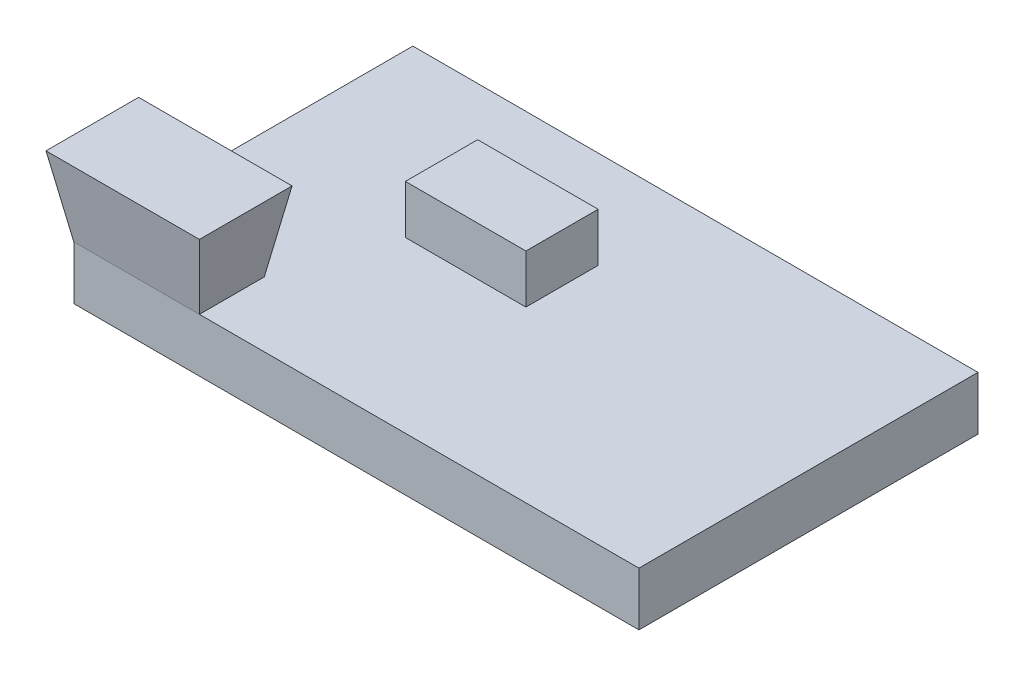
from build123d import *

# Parameters (mm, degrees)
SKETCH3_W           = 2540
SKETCH3_H           = 1524
BOSS_EXTRUDE3_DEPTH = 240.614231141
SKETCH4_W           = 564.645959203
SKETCH4_H           = 291.319549464
BOSS_EXTRUDE4_DEPTH = 354.33
BOSS_EXTRUDE4_DRAFT = -10
SKETCH9_W           = 541.61009367
SKETCH9_H           = 324.683710249
BOSS_EXTRUDE5_DEPTH = 218.44


with BuildPart() as part:
    # Sketch3 → Boss-Extrude3 (new body)
    with BuildSketch(Plane(origin=(0, 0, 0), x_dir=(1, 0, 0), z_dir=(0, 1, 0))):
        Rectangle(SKETCH3_W, SKETCH3_H)
    extrude(amount=BOSS_EXTRUDE3_DEPTH)


with BuildPart() as boss_extrude4_tool:
    # Sketch4 → Boss-Extrude4 (with draft: the straight prism first)
    with BuildSketch(Plane(origin=(0, 240.614231141, 0), x_dir=(1, 0, 0), z_dir=(0, 1, 0))):
        with Locations((-987.677020398, -616.340225268)):
            Rectangle(SKETCH4_W, SKETCH4_H)
    extrude(amount=BOSS_EXTRUDE4_DEPTH)
    # Boss-Extrude4: the draft: its side faces are tilted about the plane it starts from
    boss_extrude4_sides = [boss_extrude4_tool.faces().sort_by_distance(p)[0] for p in [
        (-987.677020399, 417.779231141, 762),
        (-705.354040797, 417.779231141, 616.340225268),
        (-987.677020399, 417.779231141, 470.680450536),
        (-1270, 417.779231141, 616.340225268),
    ]]
    draft(boss_extrude4_sides, Plane(origin=(0, 240.614231141, 0), x_dir=(1, 0, 0), z_dir=(0, 1, 0)), BOSS_EXTRUDE4_DRAFT)


with BuildPart() as part_1:
    add(part.part)

    # Boss-Extrude4: add boss_extrude4_tool
    add(boss_extrude4_tool.part)

    # Sketch9 → Boss-Extrude5 (add)
    with BuildSketch(Plane(origin=(0, 240.614231141, 0), x_dir=(1, 0, 0), z_dir=(0, 1, 0))):
        with Locations((-270.805046835, 162.341855125)):
            Rectangle(SKETCH9_W, SKETCH9_H)
    extrude(amount=BOSS_EXTRUDE5_DEPTH)


solid = part_1.part
